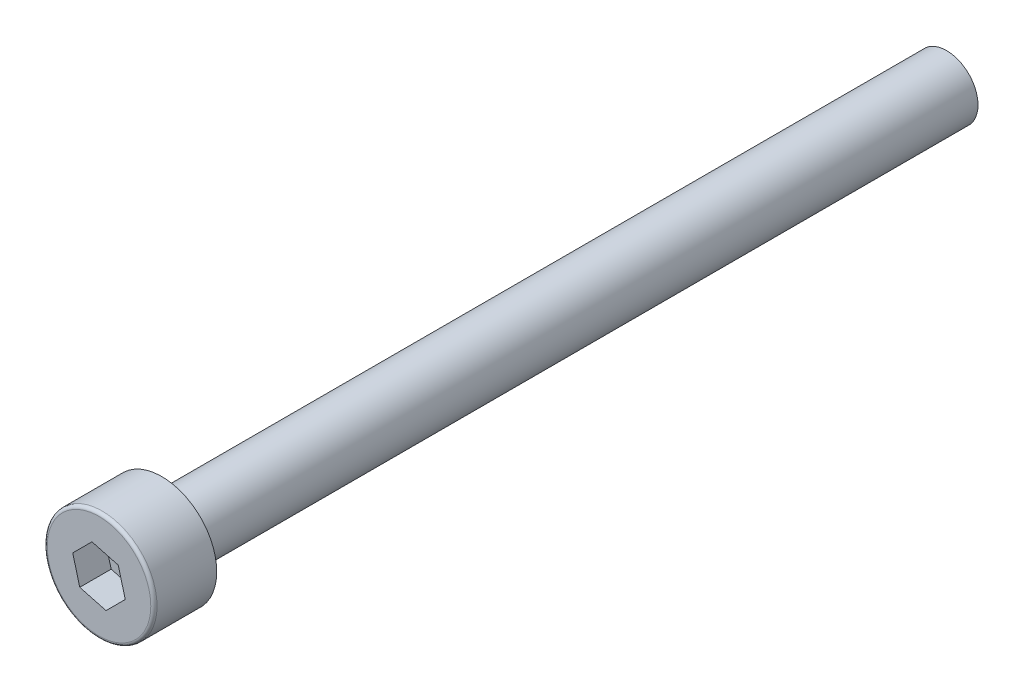
from build123d import *

# Parameters (mm, degrees)
SKETCH_1_R          = 3.5
EXTRUDE_1_DEPTH     = 4
CUT_EXTRUDE_1_DEPTH = 2
SKETCH_3_R          = 2
EXTRUDE_2_DEPTH     = 50
FILLET_1_R          = 0.2


with BuildPart() as part:
    # 草图1 → 凸台-拉伸1 (new body)
    with BuildSketch(Plane.XY):
        Circle(SKETCH_1_R)
    extrude(amount=EXTRUDE_1_DEPTH)

    # 草图2 → 切除-拉伸1 (cut)
    with BuildSketch(Plane.XY.offset(4)):
        Polygon((-1.224744871, -1.224744871), (0.448287736, -1.673032607), (1.673032607, -0.448287736), (1.224744871, 1.224744871), (-0.448287736, 1.673032607), (-1.673032607, 0.448287736), align=None)
    extrude(amount=-CUT_EXTRUDE_1_DEPTH, mode=Mode.SUBTRACT)

    # 草图3 → 凸台-拉伸2 (add)
    with BuildSketch(Plane(origin=(0, 0, 0), x_dir=(-1, 0, 0), z_dir=(0, 0, -1))):
        with Locations(Location((0, 0, 0), (0, 0, 180))):
            Circle(SKETCH_3_R)
    extrude(amount=EXTRUDE_2_DEPTH)

    # 圆角1
    fillet_1_edges = [part.edges().sort_by_distance(p)[0] for p in [
        (-3.5, 0, 4),
    ]]
    fillet(fillet_1_edges, radius=FILLET_1_R)


solid = part.part
